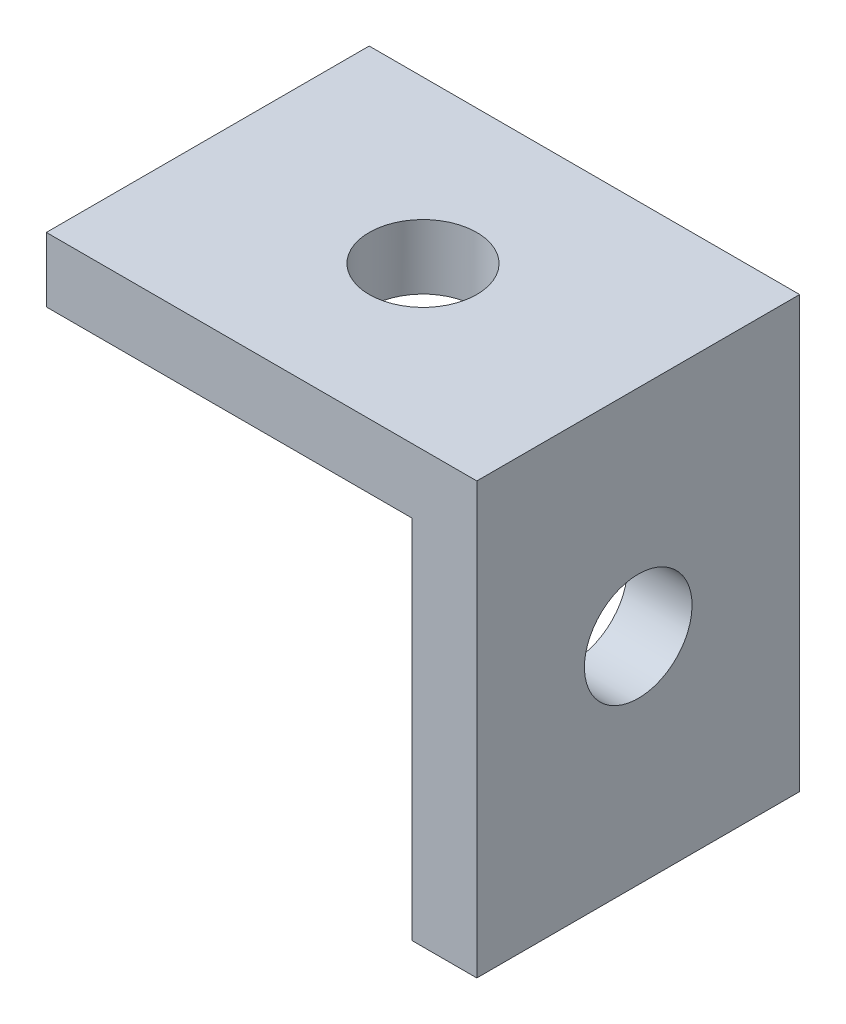
from build123d import *

# Parameters (mm, degrees)
EXTRUDE_1_DEPTH     = 15
SKETCH_2_R          = 2.5
CUT_EXTRUDE_1_DEPTH = 15
SKETCH_3_R          = 2.5
CUT_EXTRUDE_2_DEPTH = 15
SKETCH_4_W          = 22.93908914
SKETCH_4_H          = 7.177811465
CUT_EXTRUDE_3_DEPTH = 15
SKETCH_5_W          = 3.489667051
SKETCH_5_H          = 17.448335256
CUT_EXTRUDE_4_DEPTH = 15


with BuildPart() as part:
    # 스케치1 → 보스-돌출1 (new body)
    with BuildSketch(Plane.XY):
        Polygon((0, 0), (23, 0), (23, -23), (20, -23), (20, -3), (0, -3), align=None)
    extrude(amount=EXTRUDE_1_DEPTH)

    # 스케치2 → 컷-돌출1 (cut)
    with BuildSketch(Plane(origin=(0, 0, 0), x_dir=(1, 0, 0), z_dir=(0, 1, 0))):
        with Locations(Location((13, -7.5, 0), (0, 0, 270))):
            Circle(SKETCH_2_R)
    extrude(amount=-CUT_EXTRUDE_1_DEPTH, mode=Mode.SUBTRACT)

    # 스케치3 → 컷-돌출2 (cut)
    with BuildSketch(Plane(origin=(23, 0, 0), x_dir=(0, 0, -1), z_dir=(1, 0, 0))):
        with Locations(Location((-7.5, -10, 0), (0, 0, 90))):
            Circle(SKETCH_3_R)
    extrude(amount=-CUT_EXTRUDE_2_DEPTH, mode=Mode.SUBTRACT)

    # 스케치4 → 컷-돌출3 (cut)
    with BuildSketch(Plane(origin=(23, 0, 0), x_dir=(0, 0, -1), z_dir=(1, 0, 0))):
        with Locations((-7.664491513, -23.588905733)):
            Rectangle(SKETCH_4_W, SKETCH_4_H)
    extrude(amount=-CUT_EXTRUDE_3_DEPTH, mode=Mode.SUBTRACT)

    # 스케치5 → 컷-돌출4 (cut)
    with BuildSketch(Plane(origin=(0, 0, 0), x_dir=(1, 0, 0), z_dir=(0, 1, 0))):
        with Locations((1.255166474, -7.361337733)):
            Rectangle(SKETCH_5_W, SKETCH_5_H)
    extrude(amount=-CUT_EXTRUDE_4_DEPTH, mode=Mode.SUBTRACT)


solid = part.part
